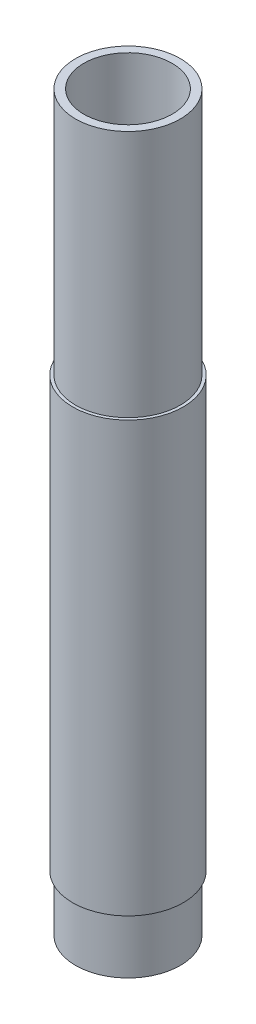
from build123d import *

# Parameters (mm, degrees)
SKETCH1_R           = 15
BOSS_EXTRUDE1_DEPTH = 155
BOSS_EXTRUDE2_START = -16
SKETCH2_R           = 15.85
BOSS_EXTRUDE2_DEPTH = 123
SKETCH3_R           = 15
BOSS_EXTRUDE3_DEPTH = 55
SKETCH6_R           = 12.65
CUT_EXTRUDE2_DEPTH  = 212.192909445


with BuildPart() as part:
    # Sketch1 → Boss-Extrude1 (new body)
    with BuildSketch(Plane(origin=(0, 0, 0), x_dir=(1, 0, 0), z_dir=(0, 1, 0))):
        with Locations(Location((0, 0, 0), (0, 0, 270))):
            Circle(SKETCH1_R)
    extrude(amount=BOSS_EXTRUDE1_DEPTH)

    # Sketch2 → Boss-Extrude2 (add)
    with BuildSketch(Plane(origin=(0, 155, 0), x_dir=(1, 0, 0), z_dir=(0, 1, 0)).offset(BOSS_EXTRUDE2_START)):
        with Locations(Location((0, 0, 0), (0, 0, 270))):
            Circle(SKETCH2_R)
    extrude(amount=-BOSS_EXTRUDE2_DEPTH)

    # Sketch3 → Boss-Extrude3 (add)
    with BuildSketch(Plane(origin=(0, 155, 0), x_dir=(1, 0, 0), z_dir=(0, 1, 0))):
        with Locations(Location((0, 0, 0), (0, 0, 270))):
            Circle(SKETCH3_R)
    extrude(amount=BOSS_EXTRUDE3_DEPTH)

    # Sketch6 → Cut-Extrude2 (cut, through all)
    with BuildSketch(Plane.XZ):
        with Locations(Location((0, 0, 0), (0, 0, 270))):
            Circle(SKETCH6_R)
    extrude(amount=-CUT_EXTRUDE2_DEPTH, mode=Mode.SUBTRACT)


solid = part.part
